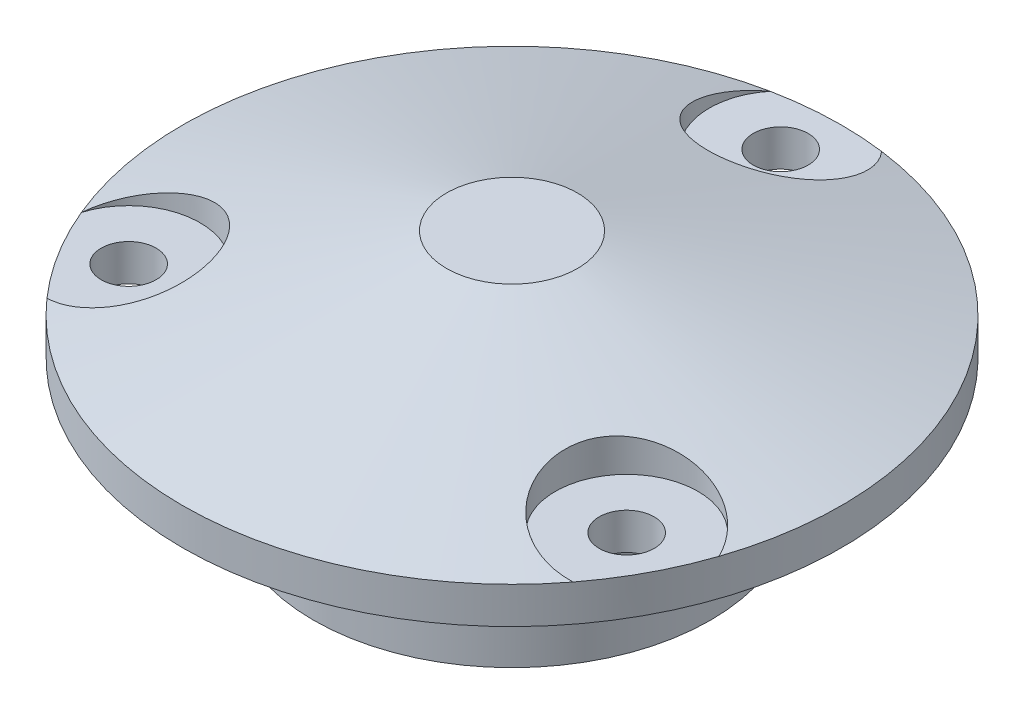
from build123d import *

# Parameters (mm, degrees)
ESQUISSE1_R             = 10.85
ESQUISSE1_R_2           = 9
BOSS_EXTRU_1_DEPTH      = 7
ESQUISSE2_R             = 18
BOSS_EXTRU_2_DEPTH      = 2
ESQUISSE4_R             = 18
BOSS_EXTRU_3_DEPTH      = 4
BOSS_EXTRU_3_TAPER      = 74.5
ESQUISSE5_R             = 1.5
ENL_V_MAT_EXTRU_1_DEPTH = 4
ESQUISSE6_R             = 3.9
ENL_V_MAT_EXTRU_2_DEPTH = 4


with BuildPart() as part:
    # Esquisse1 → Boss.-Extru.1 (new body)
    with BuildSketch(Plane(origin=(0, 0, 0), x_dir=(1, 0, 0), z_dir=(0, 1, 0))):
        with Locations(Location((0, 0, 0), (0, 0, 270))):
            Circle(ESQUISSE1_R)
        with Locations(Location((0, 0, 0), (0, 0, 270))):
            Circle(ESQUISSE1_R_2, mode=Mode.SUBTRACT)
    extrude(amount=BOSS_EXTRU_1_DEPTH)

    # Esquisse2 → Boss.-Extru.2 (add)
    with BuildSketch(Plane(origin=(0, 7, 0), x_dir=(1, 0, 0), z_dir=(0, 1, 0))):
        with Locations(Location((0, 0, 0), (0, 0, 270))):
            Circle(ESQUISSE2_R)
    extrude(amount=BOSS_EXTRU_2_DEPTH)

    # Esquisse4 → Boss.-Extru.3 (add)
    with BuildSketch(Plane(origin=(0, 9, 0), x_dir=(1, 0, 0), z_dir=(0, 1, 0))):
        with Locations(Location((0, 0, 0), (0, 0, 270))):
            Circle(ESQUISSE4_R)
    extrude(amount=BOSS_EXTRU_3_DEPTH, taper=BOSS_EXTRU_3_TAPER)

    # Esquisse5 → Enlèv. mat.-Extru.1 (cut)
    with BuildSketch(Plane.XZ.offset(-7)):
        with Locations(Location((-12.898733794, 8.041309999, 0), (0, 0, 270))):
            Circle(ESQUISSE5_R)
        with Locations(Location((13.413345636, 7.149976143, 0), (0, 0, 270))):
            Circle(ESQUISSE5_R)
        with Locations(Location((-0.514611842, -15.191286142, 0), (0, 0, 270))):
            Circle(ESQUISSE5_R)
    extrude(amount=-ENL_V_MAT_EXTRU_1_DEPTH, mode=Mode.SUBTRACT)

    # Esquisse6 → Enlèv. mat.-Extru.2 (cut)
    with BuildSketch(Plane(origin=(0, 13, 0), x_dir=(1, 0, 0), z_dir=(0, 1, 0))):
        with Locations((-0.514611842, 15.191286142)):
            Circle(ESQUISSE6_R)
        with Locations((13.413345636, -7.149976143)):
            Circle(ESQUISSE6_R)
        with Locations((-12.898733794, -8.041309999)):
            Circle(ESQUISSE6_R)
    extrude(amount=-ENL_V_MAT_EXTRU_2_DEPTH, mode=Mode.SUBTRACT)


solid = part.part
